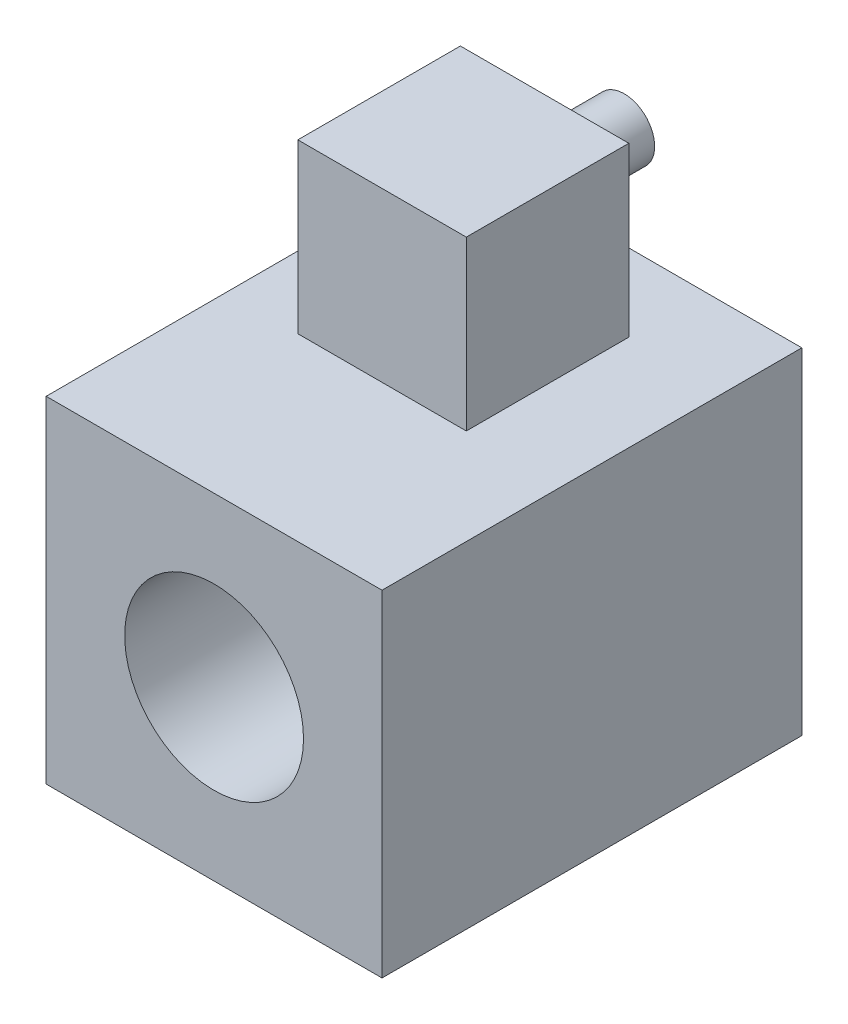
from build123d import *

# Parameters (mm, degrees)
SKETCH1_W           = 40
SKETCH1_H           = 40
BOSS_EXTRUDE1_DEPTH = 50
SKETCH2_R           = 10.65
CUT_EXTRUDE1_DEPTH  = 58.445626465
SKETCH3_W           = 20.063984789
SKETCH3_H           = 19.357087105
BOSS_EXTRUDE2_DEPTH = 20
SKETCH4_R           = 3.619370809
BOSS_EXTRUDE3_DEPTH = 10


with BuildPart() as part:
    # Sketch1 → Boss-Extrude1 (new body)
    with BuildSketch(Plane.XY):
        Rectangle(SKETCH1_W, SKETCH1_H)
    extrude(amount=BOSS_EXTRUDE1_DEPTH)

    # Sketch2 → Cut-Extrude1 (cut, through all)
    with BuildSketch(Plane.XY.offset(50)):
        Circle(SKETCH2_R)
    extrude(amount=-CUT_EXTRUDE1_DEPTH, mode=Mode.SUBTRACT)

    # Sketch3 → Boss-Extrude2 (add)
    with BuildSketch(Plane(origin=(0, 20, 0), x_dir=(1, 0, 0), z_dir=(0, 1, 0))):
        with Locations((-1.432326622, -18.882716681)):
            Rectangle(SKETCH3_W, SKETCH3_H)
    extrude(amount=BOSS_EXTRUDE2_DEPTH)

    # Sketch4 → Boss-Extrude3 (add)
    with BuildSketch(Plane(origin=(0, 0, 9.204173129), x_dir=(-1, 0, 0), z_dir=(0, 0, -1))):
        with Locations(Location((1.944917796, 31.214146172, 0), (0, 0, 180))):
            Circle(SKETCH4_R)
    extrude(amount=BOSS_EXTRUDE3_DEPTH)


solid = part.part
